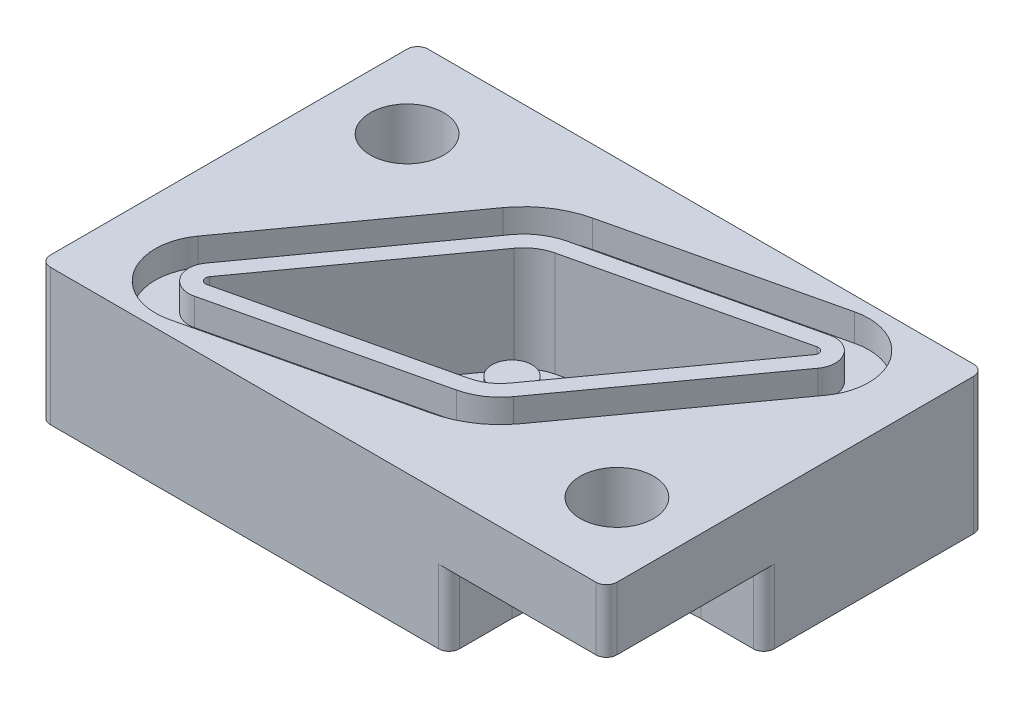
from build123d import *

# Parameters (mm, degrees)
BASES_W                = 27
BASES_H                = 18
BASE_DEPTH             = 6.5
DIAMONDCUT_DEPTH       = 5
O_RINGPROFILE_DEPTH    = 1.3
SPRINGRETENTIONS_W     = 0.95
SPRINGRETENTIONS_H     = 2.5
M3_CLEARANCE_HOLE1_D   = 3.5
MOUNTINGHOLECUTS_DEPTH = 3.5
BASEF_R                = 0.5


with BuildPart() as part:
    # BaseS → Base (new body)
    with BuildSketch(Plane(origin=(0, 0, 0), x_dir=(1, 0, 0), z_dir=(0, 1, 0))):
        Rectangle(BASES_W, BASES_H)
    extrude(amount=BASE_DEPTH)

    # DiamondCutS → DiamondCut (cut)
    with BuildSketch(Plane(origin=(0, 6.5, 0), x_dir=(1, 0, 0), z_dir=(0, 1, 0))):
        with BuildLine():
            Line((-1.566008472, 3.61128036), (8.554644537, 5.984544502))
            ThreePointArc((8.554644537, 5.984544502), (8.81973312, 5.87982208), (8.814442824, 5.594847071))
            Line((8.814442824, 5.594847071), (2.731178612, -2.834500266))
            ThreePointArc((2.731178612, -2.834500266), (2.218800785, -3.328201177), (1.566008472, -3.61128036))
            Line((1.566008472, -3.61128036), (-8.554644537, -5.984544502))
            ThreePointArc((-8.554644537, -5.984544502), (-8.81973312, -5.87982208), (-8.814442824, -5.594847071))
            Line((-8.814442824, -5.594847071), (-2.731178612, 2.834500266))
            ThreePointArc((-2.731178612, 2.834500266), (-2.218800785, 3.328201177), (-1.566008472, 3.61128036))
        make_face()
    extrude(amount=-DIAMONDCUT_DEPTH, mode=Mode.SUBTRACT)

    # O-RingProfileS → O-RingProfile (cut)
    with BuildSketch(Plane(origin=(0, 6.5, 0), x_dir=(1, 0, 0), z_dir=(0, 1, 0))):
        with BuildLine():
            Line((4.677312477, -4.238979879), (10.760576688, 4.190367458))
            ThreePointArc((10.760576688, 4.190367458), (10.816653826, 7.211102551), (8.006714841, 8.321160228))
            Line((8.006714841, 8.321160228), (-2.113938167, 5.947896086))
            ThreePointArc((-2.113938167, 5.947896086), (-3.550081256, 5.325121884), (-4.677312477, 4.238979879))
            Line((-4.677312477, 4.238979879), (-10.760576688, -4.190367458))
            ThreePointArc((-10.760576688, -4.190367458), (-10.816653826, -7.211102551), (-8.006714841, -8.321160228))
            Line((-8.006714841, -8.321160228), (2.113938167, -5.947896086))
            ThreePointArc((2.113938167, -5.947896086), (3.550081256, -5.325121884), (4.677312477, -4.238979879))
        make_face()
        with BuildLine():
            Line((3.379889901, -3.302660137), (9.463154112, 5.1266872))
            ThreePointArc((9.463154112, 5.1266872), (9.485373355, 6.323582237), (8.372001305, 6.763416411))
            Line((8.372001305, 6.763416411), (-1.748651703, 4.390152269))
            ThreePointArc((-1.748651703, 4.390152269), (-2.662560942, 3.993841413), (-3.379889901, 3.302660137))
            Line((-3.379889901, 3.302660137), (-9.463154112, -5.1266872))
            ThreePointArc((-9.463154112, -5.1266872), (-9.485373355, -6.323582237), (-8.372001305, -6.763416411))
            Line((-8.372001305, -6.763416411), (1.748651703, -4.390152269))
            ThreePointArc((1.748651703, -4.390152269), (2.662560942, -3.993841413), (3.379889901, -3.302660137))
        make_face(mode=Mode.SUBTRACT)
    extrude(amount=-O_RINGPROFILE_DEPTH, mode=Mode.SUBTRACT)

    # SpringRetentionS → SpringRetention (revolve)
    with BuildSketch(Plane(origin=(0, 0, 0), x_dir=(0, 0, -1), z_dir=(1, 0, 0))):
        with Locations((0.475, 2.75)):
            Rectangle(SPRINGRETENTIONS_W, SPRINGRETENTIONS_H)
    revolve(axis=Axis((0, 1.5, 0), (0, 1, 0)))

    # M3 Clearance Hole1 (through all)
    with Locations(Plane(origin=(0, 6.5, 0), x_dir=(-1, 0, 0), z_dir=(0, 1, 0))):
        with Locations((10, -5), (-10, 5)):
            Hole(M3_CLEARANCE_HOLE1_D / 2)

    # MountingHoleCutsS → MountingHoleCuts (cut)
    with BuildSketch(Plane.XZ):
        with BuildLine():
            Line((13.5, 1.5), (13.5, 9))
            Line((13.5, 9), (6, 9))
            Line((6, 9), (6, 6))
            ThreePointArc((6, 6), (7.318019485, 2.818019485), (10.5, 1.5))
            Line((10.5, 1.5), (13.5, 1.5))
        make_face()
        with BuildLine():
            Line((-13.5, -9), (-6, -9))
            Line((-6, -9), (-6, -6))
            ThreePointArc((-6, -6), (-7.318019485, -2.818019485), (-10.5, -1.5))
            Line((-10.5, -1.5), (-13.5, -1.5))
            Line((-13.5, -1.5), (-13.5, -9))
        make_face()
    extrude(amount=-MOUNTINGHOLECUTS_DEPTH, mode=Mode.SUBTRACT)

    # BaseF
    basef_edges = [part.edges().sort_by_distance(p)[0] for p in [
        (-6, 1.75, -9),
        (-13.5, 1.75, -1.5),
        (6, 1.75, 9),
        (13.5, 1.75, 1.5),
        (13.5, 5, 9),
        (-13.5, 3.25, 9),
        (-13.5, 5, -9),
        (13.5, 3.25, -9),
    ]]
    fillet(basef_edges, radius=BASEF_R)


solid = part.part
